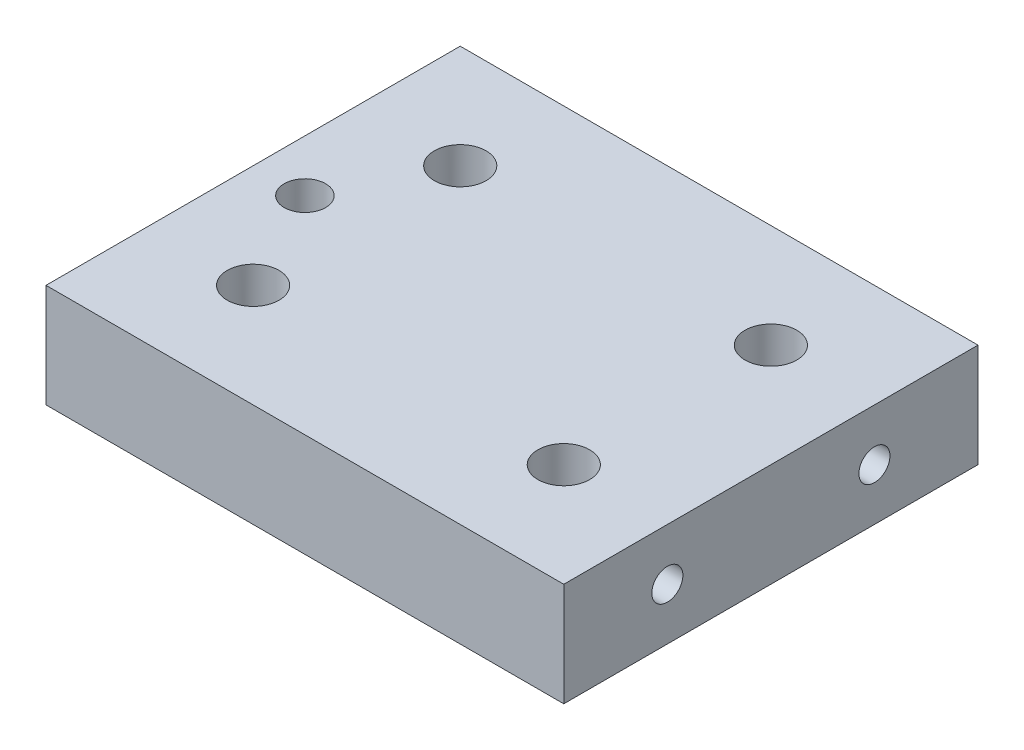
from build123d import *

# Parameters (mm, degrees)
SKETCH_1_W          = 100
SKETCH_1_H          = 80
EXTRUDE_1_DEPTH     = 20
SKETCH_2_R          = 5
SKETCH_2_R_2        = 4
CUT_EXTRUDE_1_DEPTH = 20
SKETCH_3_R          = 3
CUT_EXTRUDE_2_DEPTH = 20
CUT_EXTRUDE_START   = -20
SKETCH_4_R          = 3
CUT_EXTRUDE_3_DEPTH = 20


with BuildPart() as part:
    # Эскиз1 → Бобышка-Вытянуть1 (new body)
    with BuildSketch(Plane(origin=(0, 0, 0), x_dir=(1, 0, 0), z_dir=(0, 1, 0))):
        with Locations((50, 40)):
            Rectangle(SKETCH_1_W, SKETCH_1_H)
    extrude(amount=EXTRUDE_1_DEPTH)

    # Эскиз2 → Вырез-Вытянуть1 (cut)
    with BuildSketch(Plane.XZ):
        with Locations(Location((20, -20, 0), (0, 0, 270))):
            Circle(SKETCH_2_R)
        with Locations(Location((10, -40, 0), (0, 0, 270))):
            Circle(SKETCH_2_R_2)
        with Locations(Location((20, -60, 0), (0, 0, 270))):
            Circle(SKETCH_2_R)
        with Locations(Location((80, -20, 0), (0, 0, 270))):
            Circle(SKETCH_2_R)
        with Locations(Location((80, -60, 0), (0, 0, 270))):
            Circle(SKETCH_2_R)
    extrude(amount=-CUT_EXTRUDE_1_DEPTH, mode=Mode.SUBTRACT)

    # Эскиз3 → Вырез-Вытянуть2 (cut)
    with BuildSketch(Plane.ZY):
        with Locations((-60, 10)):
            Circle(SKETCH_3_R)
        with Locations((-20, 10)):
            Circle(SKETCH_3_R)
    extrude(amount=-CUT_EXTRUDE_2_DEPTH, mode=Mode.SUBTRACT)

    # Эскиз4 → Вырез-Вытянуть3 (cut)
    with BuildSketch(Plane(origin=(100, 0, 0), x_dir=(0, 0, -1), z_dir=(1, 0, 0)).offset(CUT_EXTRUDE_START)):
        with Locations(Location((20, 10, 0), (0, 0, 180))):
            Circle(SKETCH_4_R)
        with Locations(Location((60, 10, 0), (0, 0, 180))):
            Circle(SKETCH_4_R)
    extrude(amount=CUT_EXTRUDE_3_DEPTH, mode=Mode.SUBTRACT)


solid = part.part
